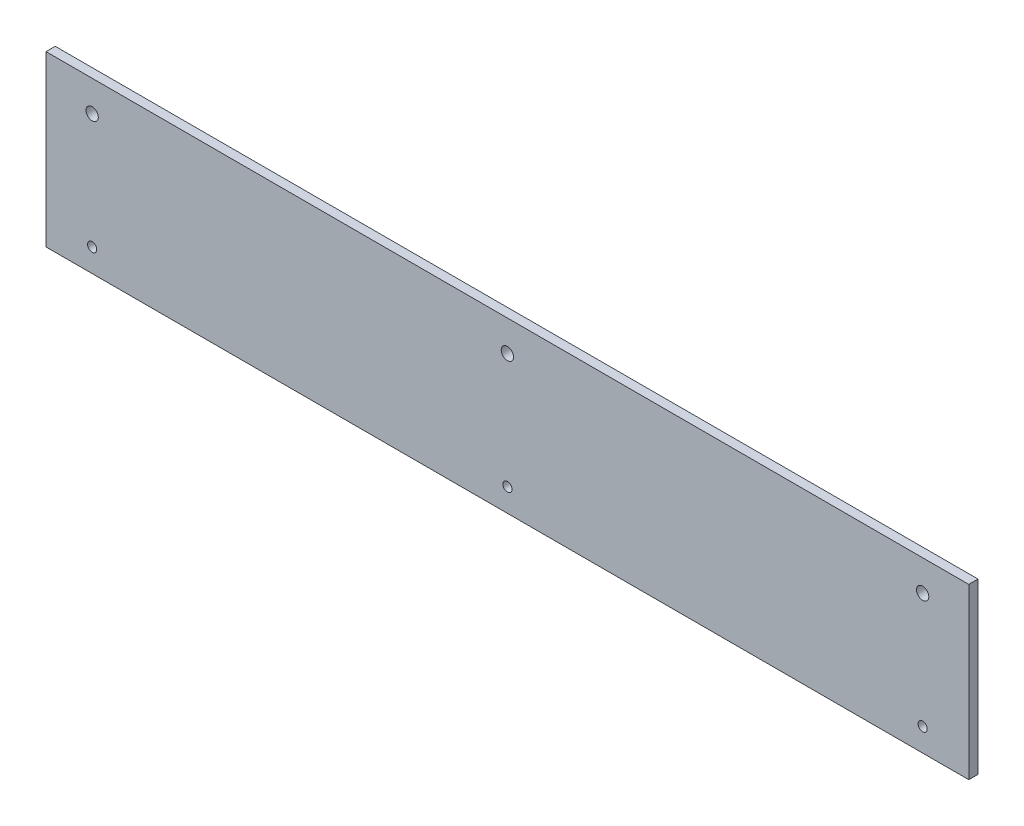
from build123d import *

# Parameters (mm, degrees)
SKETCH1_W           = 300
SKETCH1_H           = 55
SKETCH1_R           = 2
SKETCH1_R_2         = 1.5
BOSS_EXTRUDE1_DEPTH = 3


with BuildPart() as part:
    # Sketch1 → Boss-Extrude1 (new body)
    with BuildSketch(Plane.XY):
        with Locations((150, 27.5)):
            Rectangle(SKETCH1_W, SKETCH1_H)
        with Locations((15, 45)):
            Circle(SKETCH1_R, mode=Mode.SUBTRACT)
        with Locations((150, 45)):
            Circle(SKETCH1_R, mode=Mode.SUBTRACT)
        with Locations((285, 45)):
            Circle(SKETCH1_R, mode=Mode.SUBTRACT)
        with Locations((15, 7.5)):
            Circle(SKETCH1_R_2, mode=Mode.SUBTRACT)
        with Locations((150, 7.5)):
            Circle(SKETCH1_R_2, mode=Mode.SUBTRACT)
        with Locations((285, 7.5)):
            Circle(SKETCH1_R_2, mode=Mode.SUBTRACT)
    extrude(amount=BOSS_EXTRUDE1_DEPTH)


solid = part.part
